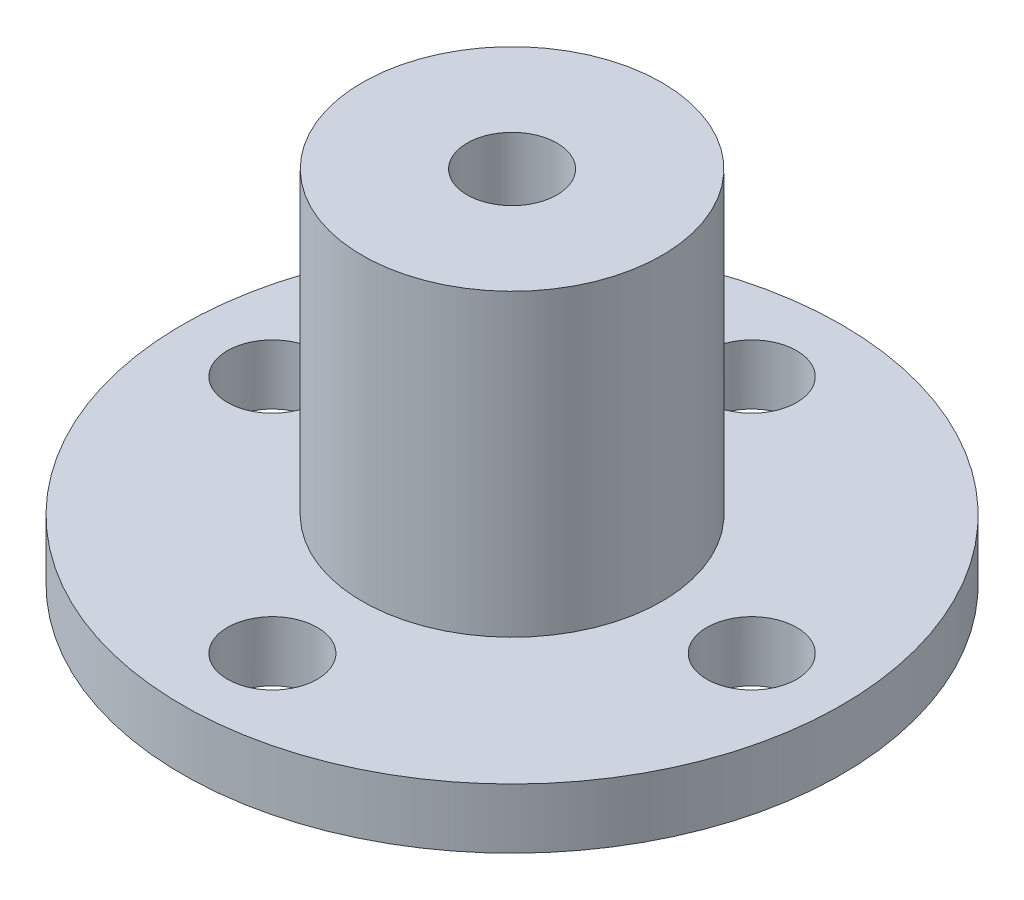
from build123d import *

# Parameters (mm, degrees)
SKETCH_7_R          = 1.5
CUT_EXTRUDE_1_DEPTH = 20.646882704
SKETCH_8_R          = 1.5
CUT_EXTRUDE_2_DEPTH = 20.646882704


with BuildPart() as part:
    # 草图1 → 旋转1 (revolve)
    with BuildSketch(Plane.XY, mode=Mode.PRIVATE) as revolve_1_sk:
        Polygon((0, 0), (0, 12), (5, 12), (5, 2), (11, 2), (11, 0), align=None)
    revolve(revolve_1_sk.sketch.rotate(Axis((0, 0, 0), (0, 1, 0)), 90), axis=Axis((0, 0, 0), (0, 1, 0)))

    # 草图7 → 切除-拉伸1 (cut, through all)
    with BuildSketch(Plane.XZ):
        with Locations(Location((0, 0, 0), (0, 0, 270))):
            Circle(SKETCH_7_R)
    extrude(amount=-CUT_EXTRUDE_1_DEPTH, mode=Mode.SUBTRACT)

    # 草图8 → 切除-拉伸2 (cut, through all)
    with BuildSketch(Plane.XZ):
        with Locations(Location((-8, 0, 0), (0, 0, 270))):
            Circle(SKETCH_8_R)
        with Locations(Location((0, 8, 0), (0, 0, 270))):
            Circle(SKETCH_8_R)
        with Locations(Location((8, 0, 0), (0, 0, 270))):
            Circle(SKETCH_8_R)
        with Locations(Location((0, -8, 0), (0, 0, 270))):
            Circle(SKETCH_8_R)
    extrude(amount=-CUT_EXTRUDE_2_DEPTH, mode=Mode.SUBTRACT)


solid = part.part
